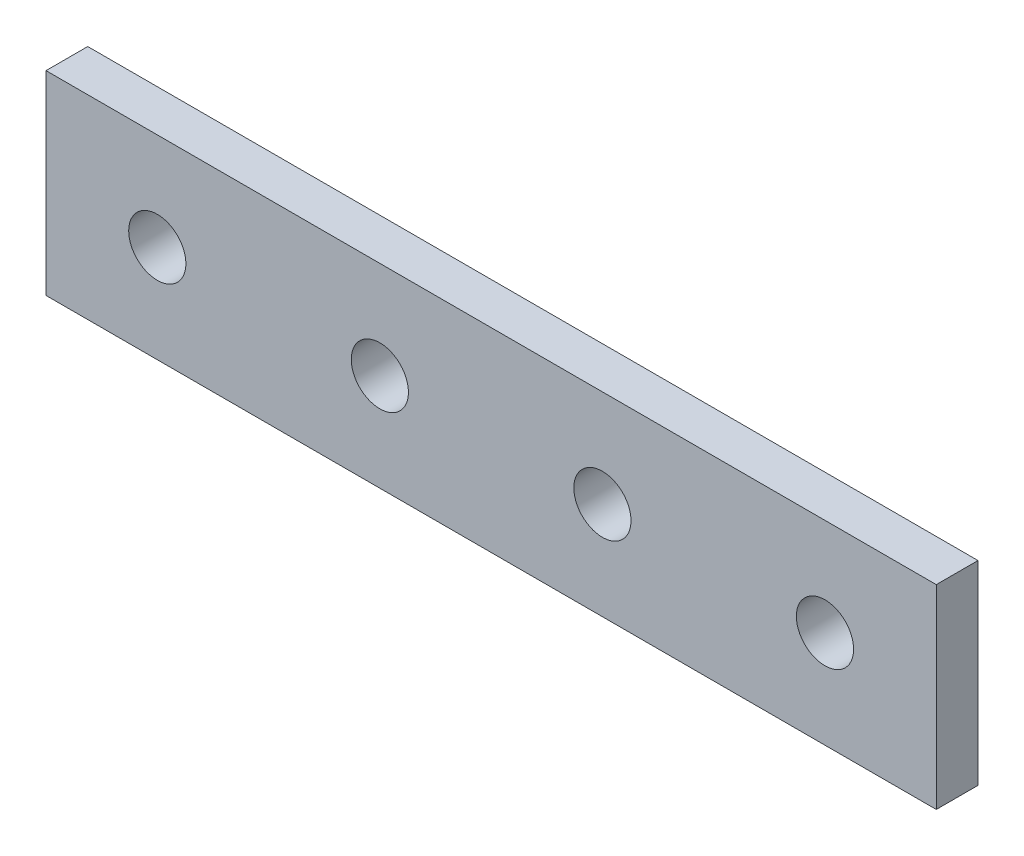
from build123d import *

# Parameters (mm, degrees)
SKETCH1_W           = 101.6
SKETCH1_H           = 22.225
SKETCH1_R           = 3.2639
BOSS_EXTRUDE1_DEPTH = 2.38125


with BuildPart() as part:
    # Sketch1 → Boss-Extrude1 (new, symmetric)
    with BuildSketch(Plane.XY):
        with Locations((50.8, 11.1125)):
            Rectangle(SKETCH1_W, SKETCH1_H)
        with Locations(Location((12.7, 11.1125, 0), (0, 0, 180))):
            Circle(SKETCH1_R, mode=Mode.SUBTRACT)
        with Locations(Location((38.1, 11.1125, 0), (0, 0, 180))):
            Circle(SKETCH1_R, mode=Mode.SUBTRACT)
        with Locations(Location((63.5, 11.1125, 0), (0, 0, 180))):
            Circle(SKETCH1_R, mode=Mode.SUBTRACT)
        with Locations(Location((88.9, 11.1125, 0), (0, 0, 180))):
            Circle(SKETCH1_R, mode=Mode.SUBTRACT)
    extrude(amount=BOSS_EXTRUDE1_DEPTH, both=True)


solid = part.part
